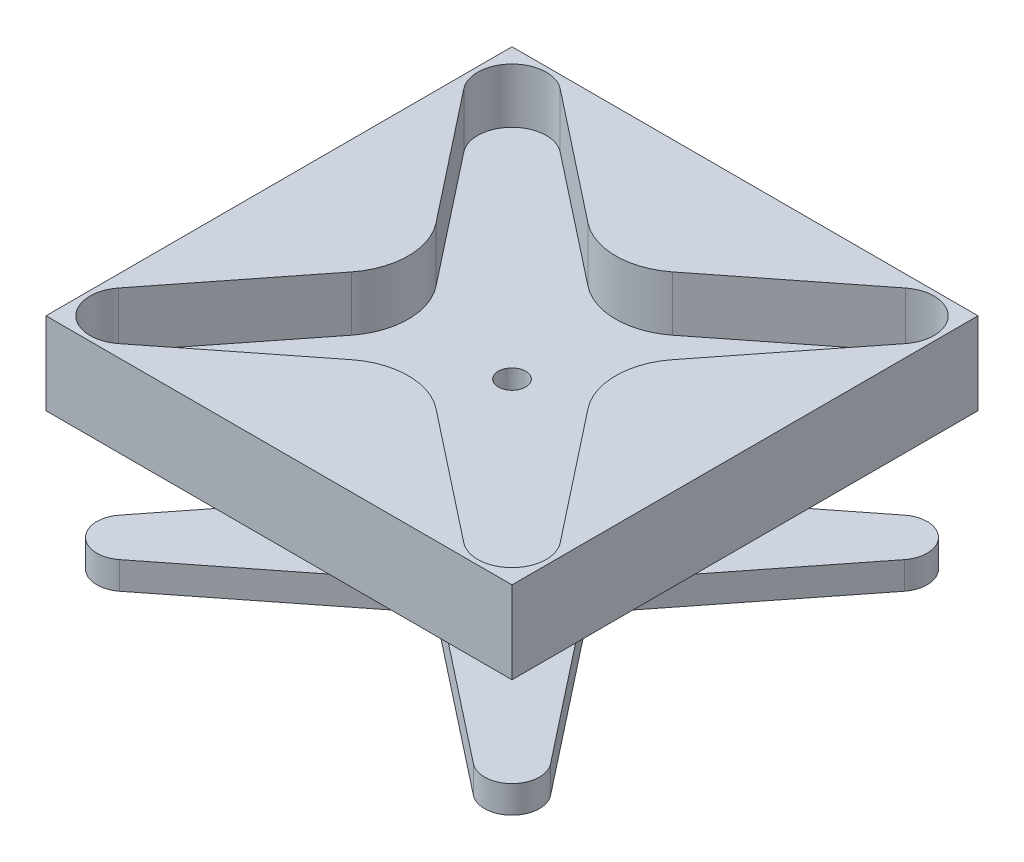
from build123d import *

# Parameters (mm, degrees)
BOSS_EXTRUDE2_DEPTH = 2
SKETCH2_W           = 34
SKETCH2_H           = 34
BOSS_EXTRUDE3_DEPTH = 6
CUT_EXTRUDE1_START  = -4
CUT_EXTRUDE1_DEPTH  = 4
FILLET1_R           = 5
SKETCH4_R           = 1
CUT_EXTRUDE2_DEPTH  = 10


with BuildPart() as part:
    # Sketch1 → Boss-Extrude2 (new body)
    with BuildSketch(Plane(origin=(0, 0, 0), x_dir=(1, 0, 0), z_dir=(0, 1, 0))):
        with BuildLine():
            Line((0, 5.568191949), (12.90346414, 15.717013375))
            ThreePointArc((12.90346414, 15.717013375), (15.558918419, 15.558918419), (15.717013375, 12.90346414))
            Line((15.717013375, 12.90346414), (5.568191949, 0))
            Line((5.568191949, 0), (15.717013375, -12.90346414))
            ThreePointArc((15.717013375, -12.90346414), (15.558918419, -15.558918419), (12.90346414, -15.717013375))
            Line((12.90346414, -15.717013375), (0, -5.568191949))
            Line((0, -5.568191949), (-12.90346414, -15.717013375))
            ThreePointArc((-12.90346414, -15.717013375), (-15.558918419, -15.558918419), (-15.717013375, -12.90346414))
            Line((-15.717013375, -12.90346414), (-5.568191949, 0))
            Line((-5.568191949, 0), (-15.717013375, 12.90346414))
            ThreePointArc((-15.717013375, 12.90346414), (-15.558918419, 15.558918419), (-12.90346414, 15.717013375))
            Line((-12.90346414, 15.717013375), (0, 5.568191949))
        make_face()
    extrude(amount=BOSS_EXTRUDE2_DEPTH)


with BuildPart() as body_2:
    # Sketch2 → Boss-Extrude3 (new body)
    with BuildSketch(Plane(origin=(0, 10, 0), x_dir=(1, 0, 0), z_dir=(0, 1, 0))):
        Rectangle(SKETCH2_W, SKETCH2_H)
    extrude(amount=BOSS_EXTRUDE3_DEPTH)

    # Sketch3 → Cut-Extrude1 (cut)
    # profile 1 of 2: a face of its own
    with BuildSketch(Plane(origin=(0, 16, 0), x_dir=(1, 0, 0), z_dir=(0, 1, 0)).offset(CUT_EXTRUDE1_START)):
        with BuildLine():
            Line((0, 6.204315433), (-12.59435783, 16.110018832))
            ThreePointArc((-12.59435783, 16.110018832), (-15.912471809, 15.912471809), (-16.110018832, 12.59435783))
            Line((-16.110018832, 12.59435783), (-6.204315433, 0))
            Line((-6.204315433, 0), (-16.110018832, -12.59435783))
            ThreePointArc((-16.110018832, -12.59435783), (-15.912471809, -15.912471809), (-12.59435783, -16.110018832))
            Line((-12.59435783, -16.110018832), (0, -6.204315433))
            Line((0, -6.204315433), (12.59435783, -16.110018832))
            ThreePointArc((12.59435783, -16.110018832), (15.912471809, -15.912471809), (16.110018832, -12.59435783))
            Line((16.110018832, -12.59435783), (6.204315433, 0))
            Line((6.204315433, 0), (16.110018832, 12.59435783))
            ThreePointArc((16.110018832, 12.59435783), (15.912471809, 15.912471809), (12.59435783, 16.110018832))
            Line((12.59435783, 16.110018832), (0, 6.204315433))
        make_face()
        with BuildLine():
            ThreePointArc((-15.717013375, -12.90346414), (-15.558918419, -15.558918419), (-12.90346414, -15.717013375))
            Line((-12.90346414, -15.717013375), (0, -5.568191949))
            Line((0, -5.568191949), (12.90346414, -15.717013375))
            ThreePointArc((12.90346414, -15.717013375), (15.558918419, -15.558918419), (15.717013375, -12.90346414))
            Line((15.717013375, -12.90346414), (5.568191949, 0))
            Line((5.568191949, 0), (15.717013375, 12.90346414))
            ThreePointArc((15.717013375, 12.90346414), (15.558918419, 15.558918419), (12.90346414, 15.717013375))
            Line((12.90346414, 15.717013375), (0, 5.568191949))
            Line((0, 5.568191949), (-12.90346414, 15.717013375))
            ThreePointArc((-12.90346414, 15.717013375), (-15.558918419, 15.558918419), (-15.717013375, 12.90346414))
            Line((-15.717013375, 12.90346414), (-5.568191949, 0))
            Line((-5.568191949, 0), (-15.717013375, -12.90346414))
        make_face(mode=Mode.SUBTRACT)
    # profile 2 of 2: a face of its own
    with BuildSketch(Plane(origin=(0, 16, 0), x_dir=(1, 0, 0), z_dir=(0, 1, 0)).offset(CUT_EXTRUDE1_START)):
        with BuildLine():
            Line((-5.568191949, 0), (-15.717013375, -12.90346414))
            ThreePointArc((-15.717013375, -12.90346414), (-15.558918419, -15.558918419), (-12.90346414, -15.717013375))
            Line((-12.90346414, -15.717013375), (0, -5.568191949))
            Line((0, -5.568191949), (12.90346414, -15.717013375))
            ThreePointArc((12.90346414, -15.717013375), (15.558918419, -15.558918419), (15.717013375, -12.90346414))
            Line((15.717013375, -12.90346414), (5.568191949, 0))
            Line((5.568191949, 0), (15.717013375, 12.90346414))
            ThreePointArc((15.717013375, 12.90346414), (15.558918419, 15.558918419), (12.90346414, 15.717013375))
            Line((12.90346414, 15.717013375), (0, 5.568191949))
            Line((0, 5.568191949), (-12.90346414, 15.717013375))
            ThreePointArc((-12.90346414, 15.717013375), (-15.558918419, 15.558918419), (-15.717013375, 12.90346414))
            Line((-15.717013375, 12.90346414), (-5.568191949, 0))
        make_face()
    extrude(amount=CUT_EXTRUDE1_DEPTH, mode=Mode.SUBTRACT)

    # Fillet1
    fillet1_edges = [body_2.edges().sort_by_distance(p)[0] for p in [
        (0, 14, -6.204315433),
        (6.204315433, 14, 0),
        (0, 14, 6.204315433),
        (-6.204315433, 14, 0),
    ]]
    fillet(fillet1_edges, radius=FILLET1_R)

    # Sketch4 → Cut-Extrude2 (cut)
    with BuildSketch(Plane(origin=(0, 12, 0), x_dir=(1, 0, 0), z_dir=(0, 1, 0))):
        with Locations(Location((0, 0, 0), (0, 0, 270))):
            Circle(SKETCH4_R)
    extrude(amount=-CUT_EXTRUDE2_DEPTH, mode=Mode.SUBTRACT)


solid = Compound([part.part, body_2.part])
